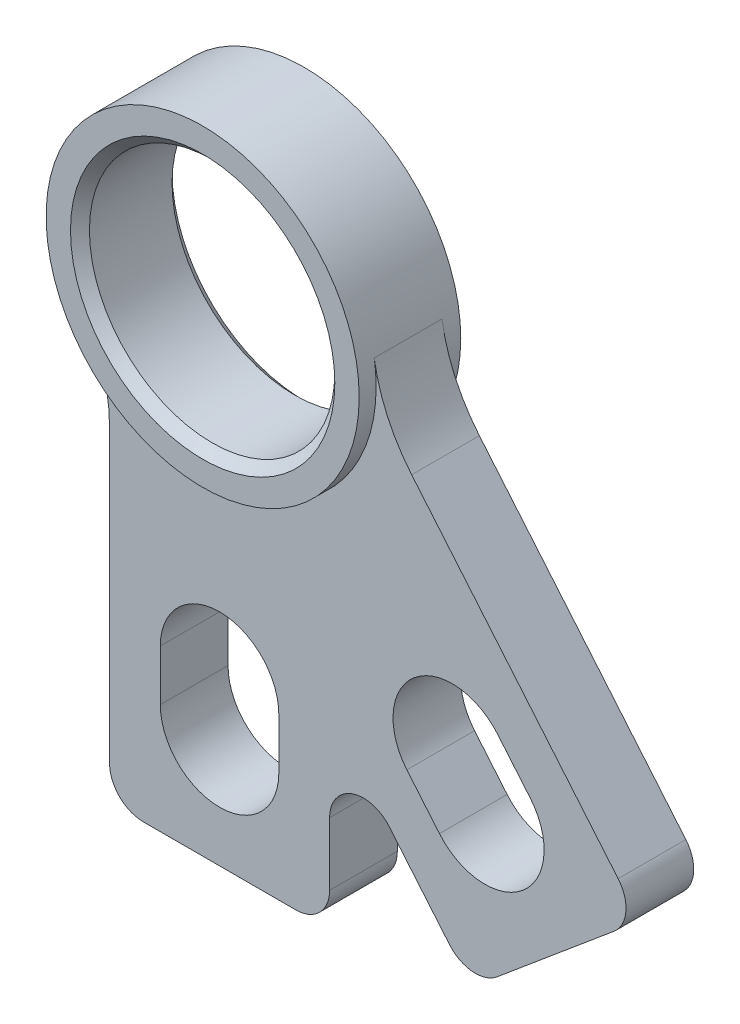
from build123d import *

# Parameters (mm, degrees)
SKETCH1_R           = 11.5062
BOSS_EXTRUDE2_DEPTH = 4.7625
BOSS_EXTRUDE3_DEPTH = 3.175
FILLET1_R           = 3.175
CHAMFER1_SIZE       = 0.889


with BuildPart() as part:
    # Sketch1 → Boss-Extrude2 (new, symmetric)
    with BuildSketch(Plane.XY):
        with BuildLine():
            ThreePointArc((14.50249678, 2.283685745), (-5.014235298, 13.798372289), (-12.585193267, -7.559797873))
            ThreePointArc((-12.585193267, -7.559797873), (5.014235298, -13.798372289), (14.50249678, 2.283685745))
        make_face()
        Circle(SKETCH1_R, mode=Mode.SUBTRACT)
    extrude(amount=BOSS_EXTRUDE2_DEPTH, both=True)

    # Sketch1<4> → Boss-Extrude3 (add, symmetric)
    with BuildSketch(Plane.XY):
        with BuildLine():
            ThreePointArc((-12.585193267, -7.559797873), (-10.89585042, -11.492870345), (-10.31875, -15.734319794))
            Line((-10.31875, -15.734319794), (-10.31875, -46.214319794))
            Line((-10.31875, -46.214319794), (10.31875, -46.214319794))
            Line((10.31875, -46.214319794), (10.31875, -28.395546995))
            Line((10.31875, -28.395546995), (23.593052407, -44.248027951))
            Line((23.593052407, -44.248027951), (39.415806291, -30.998617935))
            Line((39.415806291, -30.998617935), (18.012913188, -5.438784738))
            ThreePointArc((18.012913188, -5.438784738), (15.732337299, -1.816366769), (14.50249678, 2.283685745))
            ThreePointArc((14.50249678, 2.283685745), (5.014235298, -13.798372289), (-12.585193267, -7.559797873))
        make_face()
        with BuildLine():
            ThreePointArc((5.55625, -35.895569794), (0, -41.451819794), (-5.55625, -35.895569794))
            Line((-5.55625, -35.895569794), (-5.55625, -31.133069794))
            ThreePointArc((-5.55625, -31.133069794), (0, -25.576819794), (5.55625, -31.133069794))
            Line((5.55625, -31.133069794), (5.55625, -35.895569794))
        make_face(mode=Mode.SUBTRACT)
        with BuildLine():
            ThreePointArc((29.13969654, -26.144797151), (28.446873191, -33.971918201), (20.619752141, -33.279094852))
            Line((20.619752141, -33.279094852), (17.562195984, -29.627690109))
            ThreePointArc((17.562195984, -29.627690109), (18.255019333, -21.800569059), (26.082140383, -22.493392408))
            Line((26.082140383, -22.493392408), (29.13969654, -26.144797151))
        make_face(mode=Mode.SUBTRACT)
    extrude(amount=BOSS_EXTRUDE3_DEPTH, both=True)

    # Fillet1
    fillet1_edges = [part.edges().sort_by_distance(p)[0] for p in [
        (-10.31875, -46.214319794, 0),
        (39.415806291, -30.998617935, 0),
        (10.31875, -28.395546995, 0),
        (23.593052407, -44.248027951, 0),
        (10.31875, -46.214319794, 0),
    ]]
    fillet(fillet1_edges, radius=FILLET1_R)

    # Chamfer1
    chamfer1_edges = [part.edges().sort_by_distance(p)[0] for p in [
        (-11.5062, 0, -4.7625),
        (-11.5062, 0, 4.7625),
    ]]
    chamfer(chamfer1_edges, length=CHAMFER1_SIZE)


solid = part.part
